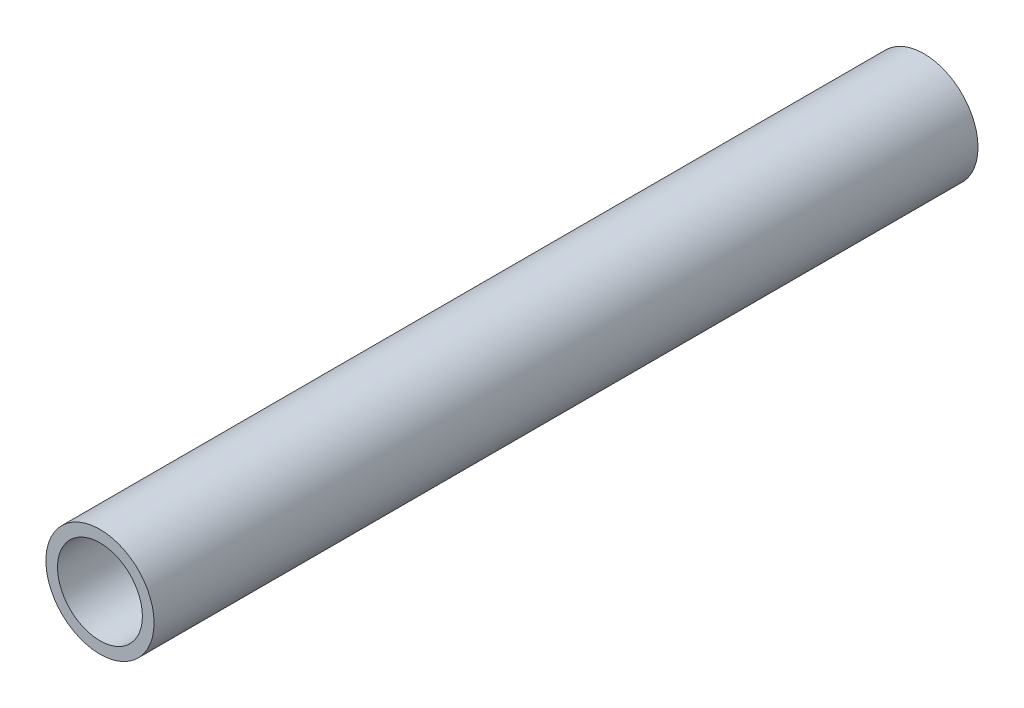
from build123d import *

# Parameters (mm, degrees)
SKETCH1_R           = 13.335
SKETCH1_R_2         = 10.4648
BOSS_EXTRUDE1_DEPTH = 203.2


with BuildPart() as part:
    # Sketch1 → Boss-Extrude1 (new body)
    with BuildSketch(Plane.XY):
        Circle(SKETCH1_R)
        Circle(SKETCH1_R_2, mode=Mode.SUBTRACT)
    extrude(amount=BOSS_EXTRUDE1_DEPTH)


solid = part.part
